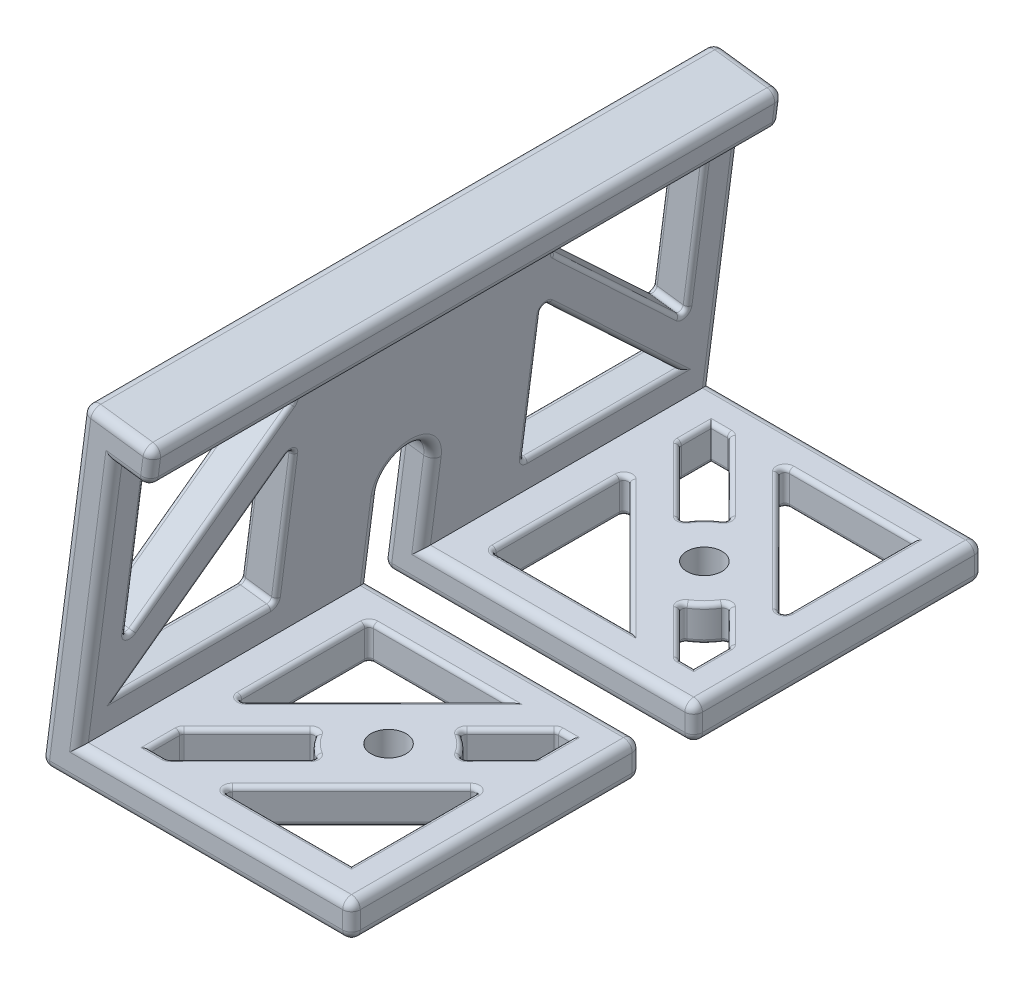
from build123d import *

# Parameters (mm, degrees)
ESQUISSE1_R                  = 1.6
BOSS_EXTRU_1_DEPTH           = 72
ESQUISSE3_R                  = 2
ESQUISSE3_W                  = 31
ESQUISSE3_H                  = 6
ENL_V_MAT_EXTRU_1_DEPTH      = 92.651062609
ENL_V_MAT_EXTRU_2_DEPTH      = 89.700538189
ENL_V_MAT_EXTRU_2_DEPTH_BACK = 89.700538189
ESQUISSE4_W                  = 13.2
ESQUISSE4_H                  = 26.875
ESQUISSE4_H_2                = 12.25
ENL_V_START                  = -4.516129
ENL_V_MAT_EXTRU_3_DEPTH      = 4.516129
CONG_1_R                     = 0.5
CONG_2_R                     = 1


with BuildPart() as part:
    # Esquisse1 → Boss.-Extru.1 (new body)
    with BuildSketch(Plane.XY):
        with BuildLine():
            Line((0, 0), (-35.55420034, 0))
            Line((-35.55420034, 0), (-33.453929351, 16.14103007))
            Line((-33.453929351, 16.14103007), (-35.309649324, 16.382496371))
            ThreePointArc((-35.309649324, 16.382496371), (-45.164845416, 20.690144809), (-34.535455776, 22.332338751))
            Line((-34.535455776, 22.332338751), (-32.679735802, 22.09087245))
            Line((-32.679735802, 22.09087245), (-30.579464813, 38.23190252))
            Line((-30.579464813, 38.23190252), (-22.646341639, 37.199644456))
            Line((-22.646341639, 37.199644456), (-23.162470671, 33.233082869))
            Line((-23.162470671, 33.233082869), (-27.129032258, 33.749211901))
            Line((-27.129032258, 33.749211901), (-31, 4))
            Line((-31, 4), (0, 4))
            Line((0, 4), (0, 0))
        make_face()
        with Locations((-39.611659195, 19.967564163)):
            Circle(ESQUISSE1_R, mode=Mode.SUBTRACT)
    extrude(amount=BOSS_EXTRU_1_DEPTH)

    # Esquisse3 → Enlèv. mat.-Extru.1 (cut, through all)
    with BuildSketch(Plane(origin=(0, 4, 0), x_dir=(1, 0, 0), z_dir=(0, 1, 0))):
        with Locations(Location((-13.78, -18, 0), (0, 0, 270))):
            Circle(ESQUISSE3_R)
        with Locations(Location((-13.78, -54, 0), (0, 0, 270))):
            Circle(ESQUISSE3_R)
        with Locations((-15.5, -36)):
            Rectangle(ESQUISSE3_W, ESQUISSE3_H)
        Polygon((-27, -43), (-11.265281374, -43), (-27, -58.734718626), align=None)
        Polygon((-4, -52.705281374), (-19.294718626, -68), (-4, -68), align=None)
        with BuildLine():
            Line((-4, -43), (-4, -47.048427125))
            Line((-4, -47.048427125), (-8.365786438, -51.414213562))
            ThreePointArc((-8.365786438, -51.414213562), (-9.537359313, -49.757359313), (-11.194213562, -48.585786438))
            Line((-11.194213562, -48.585786438), (-5.608427125, -43))
            Line((-5.608427125, -43), (-4, -43))
        make_face()
        with BuildLine():
            Line((-27, -68), (-24.951572875, -68))
            Line((-24.951572875, -68), (-16.365786438, -59.414213562))
            ThreePointArc((-16.365786438, -59.414213562), (-18.022640687, -58.242640687), (-19.194213562, -56.585786438))
            Line((-19.194213562, -56.585786438), (-27, -64.391572875))
            Line((-27, -64.391572875), (-27, -68))
        make_face()
        with BuildLine():
            Line((-4, -29), (-5.608427125, -29))
            Line((-5.608427125, -29), (-11.194213562, -23.414213562))
            ThreePointArc((-11.194213562, -23.414213562), (-9.537359313, -22.242640687), (-8.365786438, -20.585786438))
            Line((-8.365786438, -20.585786438), (-4, -24.951572875))
            Line((-4, -24.951572875), (-4, -29))
        make_face()
        Polygon((-19.294718626, -4), (-4, -4), (-4, -19.294718626), align=None)
        with BuildLine():
            Line((-27, -4), (-27, -7.608427125))
            Line((-27, -7.608427125), (-19.194213562, -15.414213562))
            ThreePointArc((-19.194213562, -15.414213562), (-18.022640687, -13.757359313), (-16.365786438, -12.585786438))
            Line((-16.365786438, -12.585786438), (-24.951572875, -4))
            Line((-24.951572875, -4), (-27, -4))
        make_face()
        Polygon((-11.265281374, -29), (-27, -13.265281374), (-27, -29), align=None)
    extrude(amount=-ENL_V_MAT_EXTRU_1_DEPTH, mode=Mode.SUBTRACT)

    # Esquisse4 → Enlèv. mat.-Extru.2 (cut, two sides: drawn at the far end of the back side and taken through both)
    with BuildSketch(Plane(origin=(2.282511151, 17.541584537, 0), x_dir=(0.9916403967057672, -0.12903225806451932, 0), z_dir=(0.12903225806451932, 0.9916403967057672, 0)).offset(-ENL_V_MAT_EXTRU_2_DEPTH_BACK)):
        with Locations((-41.85698133, -12.4375)):
            Rectangle(ESQUISSE4_W, ESQUISSE4_H)
        with Locations((-41.85698133, -36)):
            Rectangle(ESQUISSE4_W, ESQUISSE4_H_2)
        with Locations((-41.85698133, -59.5625)):
            Rectangle(ESQUISSE4_W, ESQUISSE4_H)
    extrude(amount=ENL_V_MAT_EXTRU_2_DEPTH + ENL_V_MAT_EXTRU_2_DEPTH_BACK, mode=Mode.SUBTRACT)

    # Esquisse5 → Enlèv. mat.-Extru.3 (cut)
    with BuildSketch(Plane(origin=(-34.962246953, 4.549287914, 0), x_dir=(0, 0, 1), z_dir=(-0.9916403967057675, 0.12903225806451624, 0)).offset(ENL_V_START)):
        Polygon((4, 25.966561587), (21.875, 25.966561587), (4, 8.937050726), align=None)
        Polygon((4, 3.412361246), (21.875, 3.412361246), (21.875, 20.441872107), align=None)
        with BuildLine():
            Line((33, 9.412361246), (33, -4.587638754))
            Line((33, -4.587638754), (39, -4.587638754))
            Line((39, -4.587638754), (39, 9.412361246))
            ThreePointArc((39, 9.412361246), (36, 12.412361246), (33, 9.412361246))
        make_face()
        Polygon((68, 3.412361246), (50.125, 20.441872107), (50.125, 3.412361246), align=None)
        Polygon((68, 25.966561587), (68, 8.937050726), (50.125, 25.966561587), align=None)
    extrude(amount=ENL_V_MAT_EXTRU_3_DEPTH, mode=Mode.SUBTRACT)

    # Congé1
    cong_1_edges = [part.edges().sort_by_distance(p)[0] for p in [
        (-4.804213562, 0, 43),
        (-5.608427125, 2, 43),
        (-4, 0, 45.024213562),
        (-6.182893219, 0, 49.231320344),
        (-4, 2, 47.048427125),
        (-9.537359313, 0, 49.757359313),
        (-8.365786438, 2, 51.414213562),
        (-8.401320344, 0, 45.792893219),
        (-11.194213562, 2, 48.585786438),
        (-4.804213562, 4, 43),
        (-8.401320344, 4, 45.792893219),
        (-9.537359313, 4, 49.757359313),
        (-6.182893219, 4, 49.231320344),
        (-4, 4, 45.024213562),
        (-4, 0, 60.352640687),
        (-4, 2, 52.705281374),
        (-11.647359313, 0, 68),
        (-11.647359313, 0, 60.352640687),
        (-19.294718626, 2, 68),
        (-4, 4, 60.352640687),
        (-11.647359313, 4, 60.352640687),
        (-11.647359313, 4, 68),
        (-27, 0, 50.867359313),
        (-27, 2, 58.734718626),
        (-19.132640687, 0, 43),
        (-27, 2, 43),
        (-19.132640687, 0, 50.867359313),
        (-27, 4, 50.867359313),
        (-19.132640687, 4, 50.867359313),
        (-19.132640687, 4, 43),
        (-19.132640687, 0, 29),
        (-27, 0, 21.132640687),
        (-27, 2, 29),
        (-19.132640687, 0, 21.132640687),
        (-27, 2, 13.265281374),
        (-19.132640687, 4, 29),
        (-19.132640687, 4, 21.132640687),
        (-27, 4, 21.132640687),
        (-25.975786438, 0, 4),
        (-20.658679656, 0, 8.292893219),
        (-24.951572875, 2, 4),
        (-18.022640687, 0, 13.757359313),
        (-16.365786438, 2, 12.585786438),
        (-23.097106781, 0, 11.511320344),
        (-19.194213562, 2, 15.414213562),
        (-27, 0, 5.804213562),
        (-27, 2, 7.608427125),
        (-25.975786438, 4, 4),
        (-27, 4, 5.804213562),
        (-23.097106781, 4, 11.511320344),
        (-18.022640687, 4, 13.757359313),
        (-20.658679656, 4, 8.292893219),
        (-27.64516129, 29.782650314, 59.0625),
        (-29.628442084, 30.04071483, 50.125),
        (-28.74383941, 21.339074861, 68),
        (-28.74383941, 21.339074861, 59.0625),
        (-31.825798324, 13.153563925, 68),
        (-31.611722877, 30.298779347, 59.0625),
        (-32.710400997, 21.855203894, 59.0625),
        (-32.710400997, 21.855203894, 68),
        (-28.74383941, 21.339074861, 4),
        (-31.825798324, 13.153563925, 4),
        (-27.64516129, 29.782650314, 12.9375),
        (-28.74383941, 21.339074861, 12.9375),
        (-29.628442084, 30.04071483, 21.875),
        (-32.710400997, 21.855203894, 4),
        (-32.710400997, 21.855203894, 12.9375),
        (-31.611722877, 30.298779347, 12.9375),
        (-29.456702569, 15.860569594, 12.9375),
        (-29.456702569, 15.860569594, 21.875),
        (-30.341305242, 24.562209563, 21.875),
        (-30.555380689, 7.416994141, 12.9375),
        (-32.538661482, 7.675058658, 21.875),
        (-33.423264156, 16.376698627, 12.9375),
        (-34.521942276, 7.933123174, 12.9375),
        (-33.423264156, 16.376698627, 21.875),
        (-30.555380689, 7.416994141, 59.0625),
        (-29.456702569, 15.860569594, 50.125),
        (-32.538661482, 7.675058658, 50.125),
        (-29.456702569, 15.860569594, 59.0625),
        (-30.341305242, 24.562209563, 50.125),
        (-34.521942276, 7.933123174, 59.0625),
        (-33.423264156, 16.376698627, 59.0625),
        (-33.423264156, 16.376698627, 50.125),
        (-11.647359313, 0, 11.647359313),
        (-4, 2, 19.294718626),
        (-11.647359313, 0, 4),
        (-19.294718626, 2, 4),
        (-4, 0, 11.647359313),
        (-11.647359313, 4, 11.647359313),
        (-4, 4, 11.647359313),
        (-11.647359313, 4, 4),
        (-4, 0, 26.975786438),
        (-4, 2, 24.951572875),
        (-4.804213562, 0, 29),
        (-8.401320344, 0, 26.207106781),
        (-5.608427125, 2, 29),
        (-9.537359313, 0, 22.242640687),
        (-11.194213562, 2, 23.414213562),
        (-6.182893219, 0, 22.768679656),
        (-8.365786438, 2, 20.585786438),
        (-4, 4, 26.975786438),
        (-6.182893219, 4, 22.768679656),
        (-9.537359313, 4, 22.242640687),
        (-8.401320344, 4, 26.207106781),
        (-4.804213562, 4, 29),
        (-27, 0, 66.195786438),
        (-23.097106781, 0, 60.488679656),
        (-27, 2, 64.391572875),
        (-18.022640687, 0, 58.242640687),
        (-19.194213562, 2, 56.585786438),
        (-20.658679656, 0, 63.707106781),
        (-16.365786438, 2, 59.414213562),
        (-25.975786438, 0, 68),
        (-24.951572875, 2, 68),
        (-27, 4, 66.195786438),
        (-25.975786438, 4, 68),
        (-20.658679656, 4, 63.707106781),
        (-18.022640687, 4, 58.242640687),
        (-23.097106781, 4, 60.488679656),
    ]]
    fillet(cong_1_edges, radius=CONG_1_R)

    # Congé2
    cong_2_edges = [part.edges().sort_by_distance(p)[0] for p in [
        (-17.77710017, 0, 33),
        (0, 2, 33),
        (-17.77710017, 0, 39),
        (0, 2, 39),
        (-15.5, 4, 39),
        (-15.5, 4, 33),
        (-17.77710017, 0, 0),
        (-33.066832577, 19.11595126, 0),
        (-29.064516129, 18.874605951, 72),
        (-26.612903226, 37.715773488, 0),
        (-22.904406155, 35.216363662, 0),
        (-25.145751465, 33.491147385, 0),
        (-29.064516129, 18.874605951, 0),
        (-15.5, 4, 0),
        (0, 2, 0),
        (-25.145751465, 33.491147385, 72),
        (0, 0, 55.5),
        (-35.55420034, 0, 55.5),
        (-22.904406155, 35.216363662, 72),
        (-30.579464813, 38.23190252, 36),
        (-22.646341639, 37.199644456, 36),
        (-23.162470671, 33.233082869, 36),
        (0, 4, 55.5),
        (-26.612903226, 37.715773488, 72),
        (-35.55420034, 0, 16.5),
        (-33.066832577, 19.11595126, 72),
        (-29.394090367, 16.341757712, 36),
        (-30.39059357, 8.683418261, 39),
        (-30.39059357, 8.683418261, 33),
        (-34.650974534, 6.941482777, 39),
        (-33.360651953, 16.857886744, 36),
        (-34.650974534, 6.941482777, 33),
        (0, 0, 16.5),
        (-17.77710017, 0, 72),
        (0, 2, 72),
        (0, 4, 16.5),
        (-15.5, 4, 72),
    ]]
    fillet(cong_2_edges, radius=CONG_2_R)


solid = part.part
